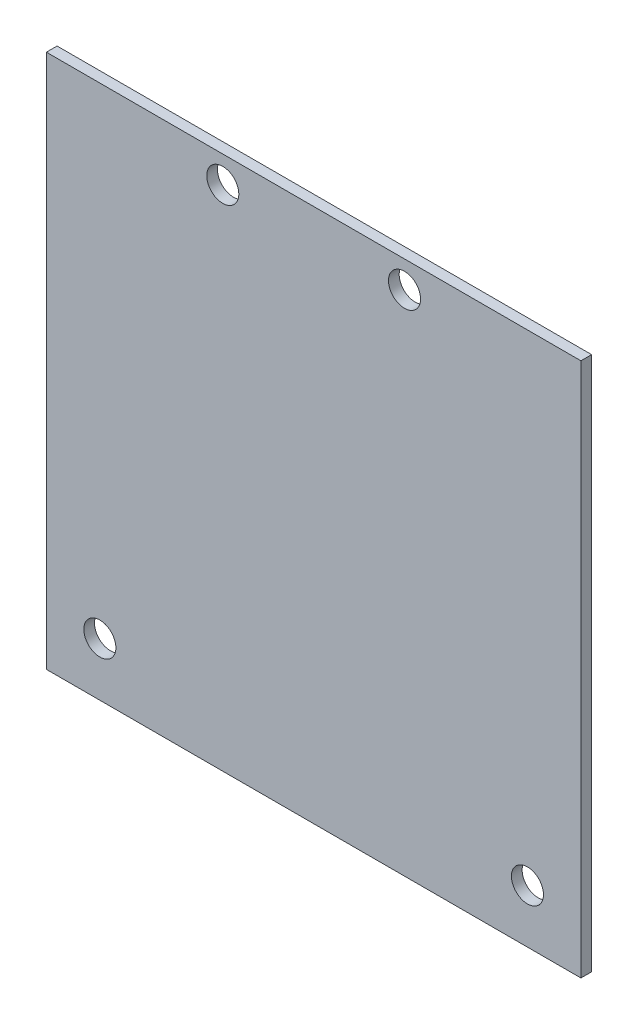
from build123d import *

# Parameters (mm, degrees)
IZIM1_W                     = 50
IZIM1_H                     = 50
IZIM1_R                     = 1.5
Y_KSEKLIK_EKSTR_ZYON1_DEPTH = 1


with BuildPart() as part:
    # Çizim1 → Yükseklik-Ekstrüzyon1 (new body)
    with BuildSketch(Plane.XY):
        with Locations((25, 25)):
            Rectangle(IZIM1_W, IZIM1_H)
        with Locations((16.5, 47.5)):
            Circle(IZIM1_R, mode=Mode.SUBTRACT)
        with Locations((33.5, 47.5)):
            Circle(IZIM1_R, mode=Mode.SUBTRACT)
        with Locations((5, 5)):
            Circle(IZIM1_R, mode=Mode.SUBTRACT)
        with Locations((45, 5)):
            Circle(IZIM1_R, mode=Mode.SUBTRACT)
    extrude(amount=Y_KSEKLIK_EKSTR_ZYON1_DEPTH)


solid = part.part
